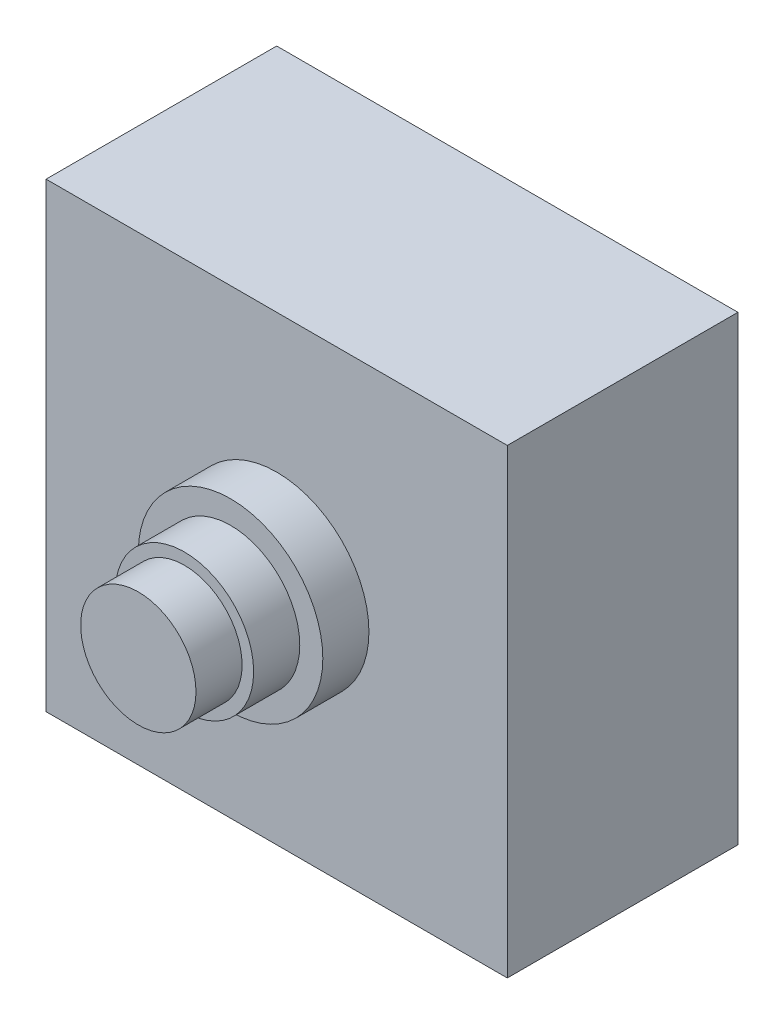
from build123d import *

# Parameters (mm, degrees)
SKETCH1_W           = 200
SKETCH1_H           = 200
BOSS_EXTRUDE1_DEPTH = 100
SKETCH2_R           = 40
BOSS_EXTRUDE2_DEPTH = 20
SKETCH3_R           = 30
BOSS_EXTRUDE3_DEPTH = 20
SKETCH4_R           = 25
BOSS_EXTRUDE4_DEPTH = 20


with BuildPart() as part:
    # Sketch1 → Boss-Extrude1 (new body)
    with BuildSketch(Plane.XY):
        Rectangle(SKETCH1_W, SKETCH1_H)
    extrude(amount=BOSS_EXTRUDE1_DEPTH)

    # Sketch2 → Boss-Extrude2 (add)
    with BuildSketch(Plane.XY.offset(100)):
        Circle(SKETCH2_R)
    extrude(amount=BOSS_EXTRUDE2_DEPTH)

    # Sketch3 → Boss-Extrude3 (add)
    with BuildSketch(Plane.XY.offset(120)):
        Circle(SKETCH3_R)
    extrude(amount=BOSS_EXTRUDE3_DEPTH)

    # Sketch4 → Boss-Extrude4 (add)
    with BuildSketch(Plane.XY.offset(140)):
        Circle(SKETCH4_R)
    extrude(amount=BOSS_EXTRUDE4_DEPTH)


solid = part.part
